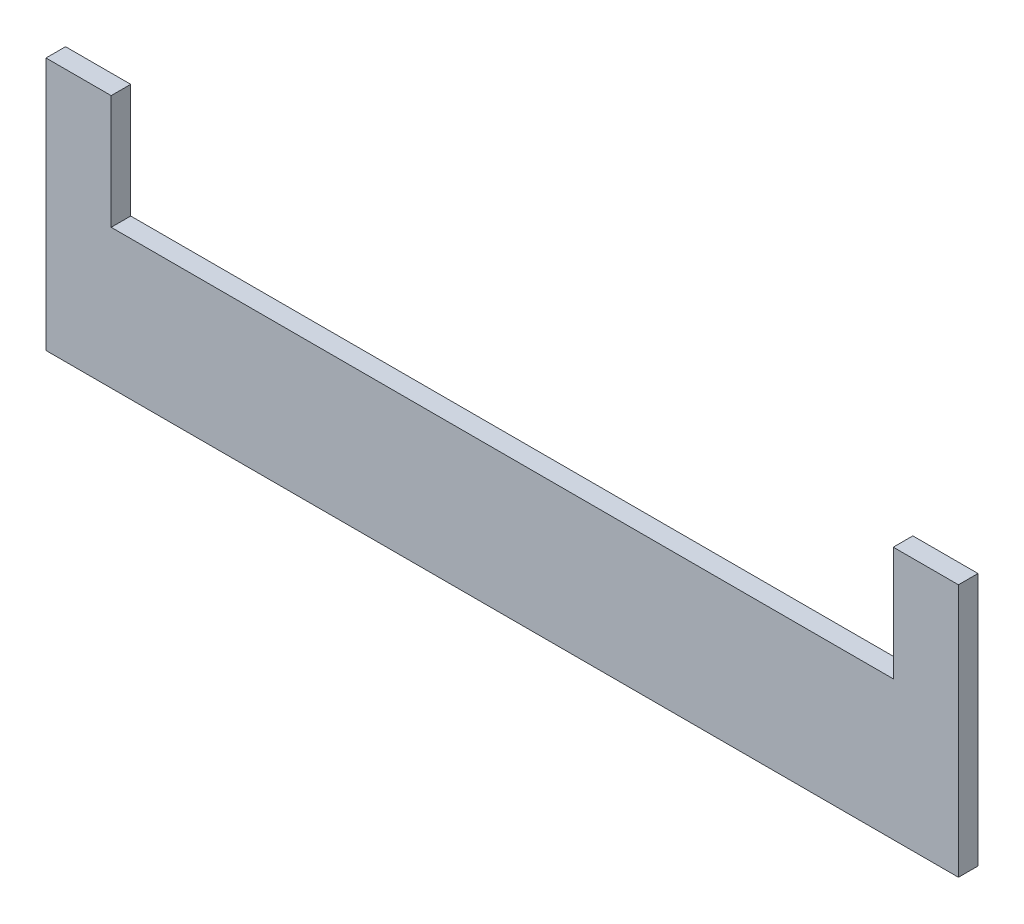
from build123d import *

# Parameters (mm, degrees)
BOSS_EXTRUDE1_DEPTH = 1.2


with BuildPart() as part:
    # Sketch1 → Boss-Extrude1 (new body)
    with BuildSketch(Plane.XY):
        Polygon((28, 0), (-28, 0), (-28, 15.5489795), (-24, 15.5489795), (-24, 8.5489795), (24, 8.5489795), (24, 15.5489795), (28, 15.5489795), align=None)
    extrude(amount=BOSS_EXTRUDE1_DEPTH)


solid = part.part
